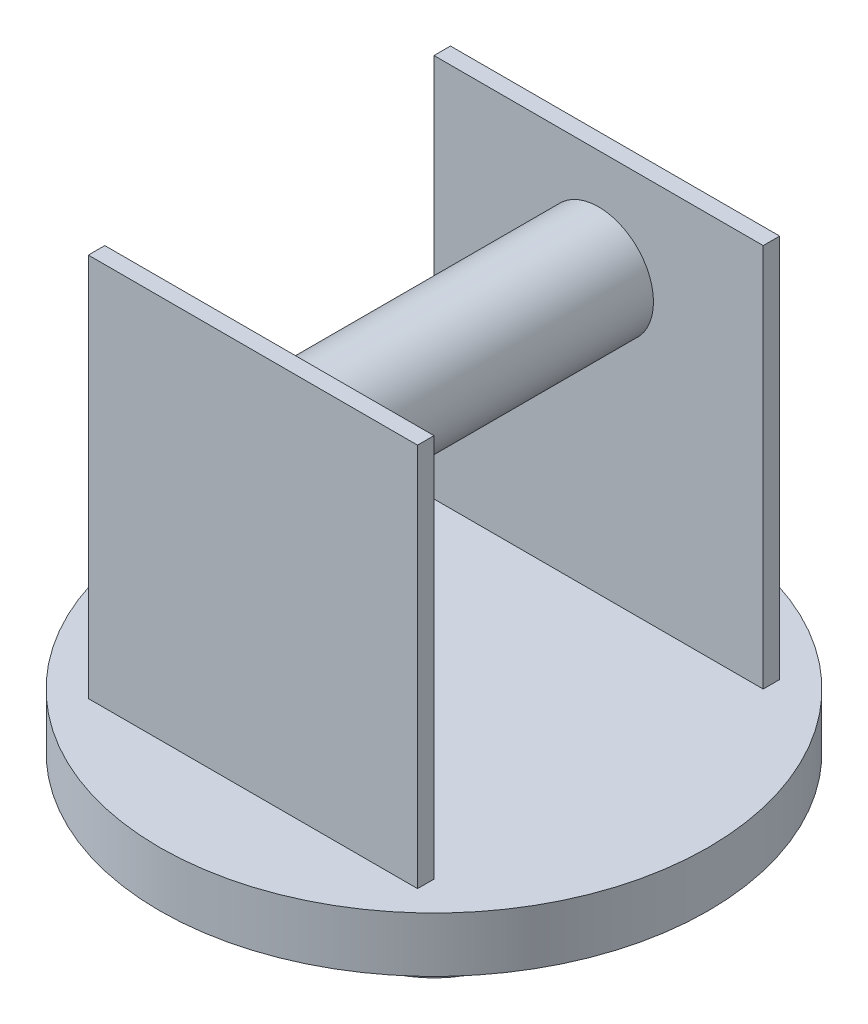
from build123d import *

# Parameters (mm, degrees)
SKETCH1_R           = 50
BOSS_EXTRUDE1_DEPTH = 10
SKETCH2_R           = 15
BOSS_EXTRUDE2_DEPTH = 25
SKETCH3_W           = 60
SKETCH3_H           = 3
BOSS_EXTRUDE3_DEPTH = 70
SKETCH4_R           = 10
BOSS_EXTRUDE4_DEPTH = 63


with BuildPart() as part:
    # Sketch1 → Boss-Extrude1 (new body)
    with BuildSketch(Plane(origin=(0, 0, 0), x_dir=(1, 0, 0), z_dir=(0, 1, 0))):
        with Locations(Location((0, 0, 0), (0, 0, 270))):
            Circle(SKETCH1_R)
    extrude(amount=BOSS_EXTRUDE1_DEPTH)

    # Sketch2 → Boss-Extrude2 (add)
    with BuildSketch(Plane(origin=(0, 0, 0), x_dir=(-1, 0, 0), z_dir=(0, -1, 0))):
        with Locations(Location((0, 0, 0), (0, 0, 90))):
            Circle(SKETCH2_R)
    extrude(amount=BOSS_EXTRUDE2_DEPTH)

    # Sketch3 → Boss-Extrude3 (add)
    with BuildSketch(Plane(origin=(0, 10, 0), x_dir=(1, 0, 0), z_dir=(0, 1, 0))):
        with Locations((0, -31.5)):
            Rectangle(SKETCH3_W, SKETCH3_H)
        with Locations((0, 31.5)):
            Rectangle(SKETCH3_W, SKETCH3_H)
    extrude(amount=BOSS_EXTRUDE3_DEPTH)

    # Sketch4 → Boss-Extrude4 (add)
    with BuildSketch(Plane.XY.offset(33)):
        with Locations((0, 61.110810205)):
            Circle(SKETCH4_R)
    extrude(amount=-BOSS_EXTRUDE4_DEPTH)


solid = part.part
